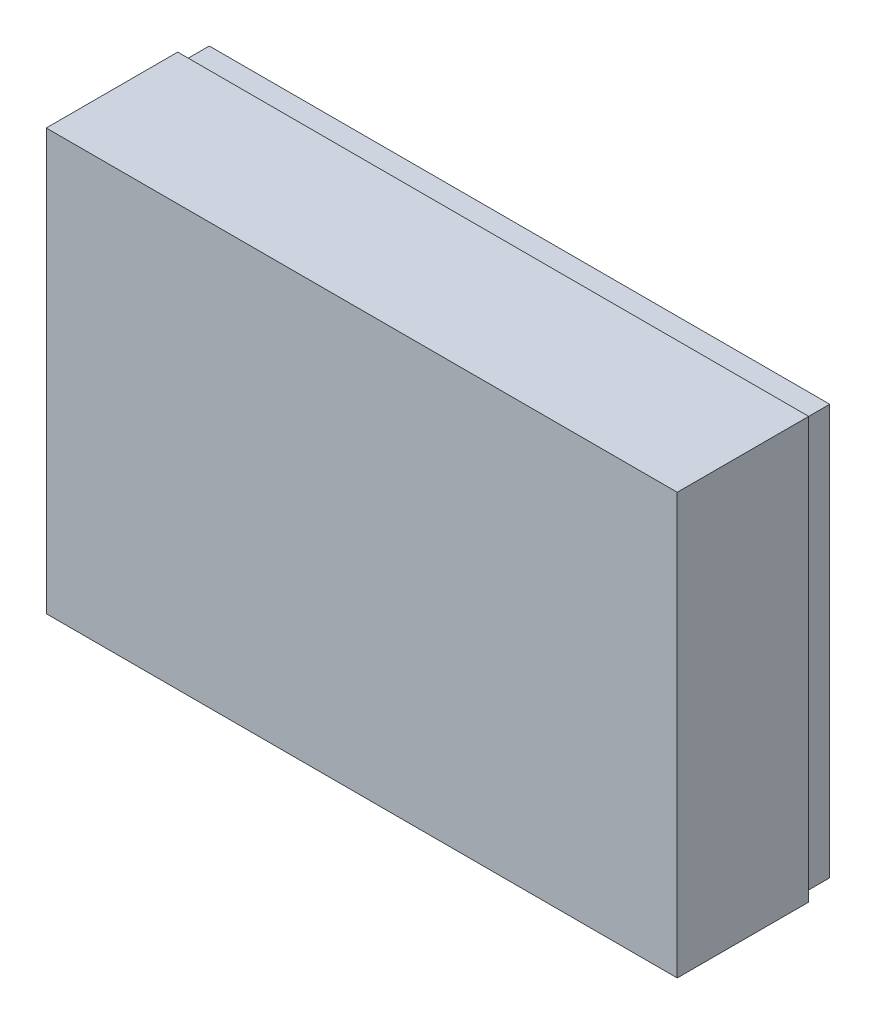
from build123d import *

# Parameters (mm, degrees)
SKETCH1_W           = 120
SKETCH1_H           = 80
BOSS_EXTRUDE1_DEPTH = 30
SHELL1_T            = -2
SKETCH10_W          = 120
SKETCH10_H          = 80
SKETCH10_W_2        = 118
SKETCH10_H_2        = 78
CUT_EXTRUDE1_DEPTH  = 5


with BuildPart() as part:
    # Sketch1 → Boss-Extrude1 (new body)
    with BuildSketch(Plane.XY):
        Rectangle(SKETCH1_W, SKETCH1_H)
    extrude(amount=BOSS_EXTRUDE1_DEPTH)

    # Shell1
    shell1_openings = [part.faces().sort_by_distance(p)[0] for p in [
        (0, 0, 0),
    ]]
    offset(amount=SHELL1_T, openings=shell1_openings, kind=Kind.INTERSECTION)

    # Sketch10 → Cut-Extrude1 (cut)
    with BuildSketch(Plane(origin=(0, 0, 0), x_dir=(-1, 0, 0), z_dir=(0, 0, -1))):
        Rectangle(SKETCH10_W, SKETCH10_H)
        Rectangle(SKETCH10_W_2, SKETCH10_H_2, mode=Mode.SUBTRACT)
    extrude(amount=-CUT_EXTRUDE1_DEPTH, mode=Mode.SUBTRACT)


solid = part.part
